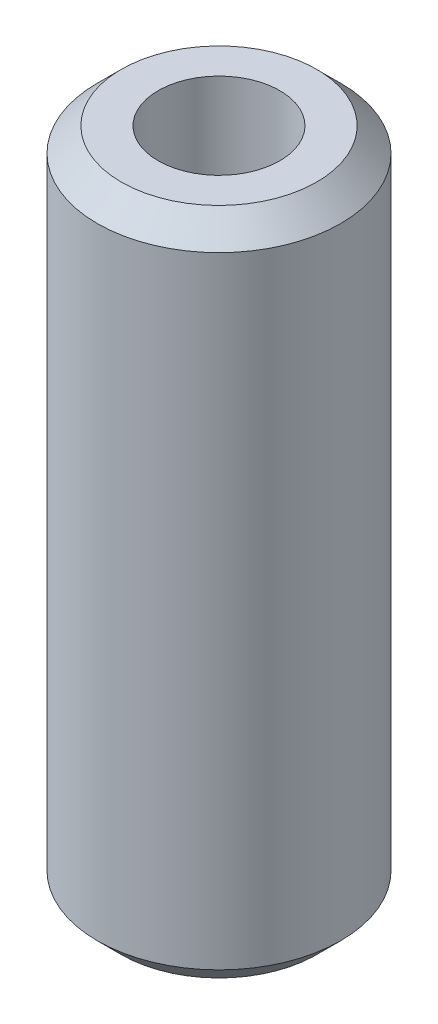
from build123d import *

# Parameters (mm, degrees)
SKETCH1_R           = 12.7
SKETCH1_R_2         = 6.35
BOSS_EXTRUDE1_DEPTH = 69.85
CHAMFER1_SIZE       = 2.5


with BuildPart() as part:
    # Sketch1 → Boss-Extrude1 (new body)
    with BuildSketch(Plane(origin=(0, 0, 0), x_dir=(1, 0, 0), z_dir=(0, 1, 0))):
        with Locations(Location((0, 0, 0), (0, 0, 270))):
            Circle(SKETCH1_R)
        with Locations(Location((0, 0, 0), (0, 0, 270))):
            Circle(SKETCH1_R_2, mode=Mode.SUBTRACT)
    extrude(amount=BOSS_EXTRUDE1_DEPTH)

    # Chamfer1
    chamfer1_edges = [part.edges().sort_by_distance(p)[0] for p in [
        (0, 0, -12.7),
        (0, 69.85, -12.7),
    ]]
    chamfer(chamfer1_edges, length=CHAMFER1_SIZE)


solid = part.part
